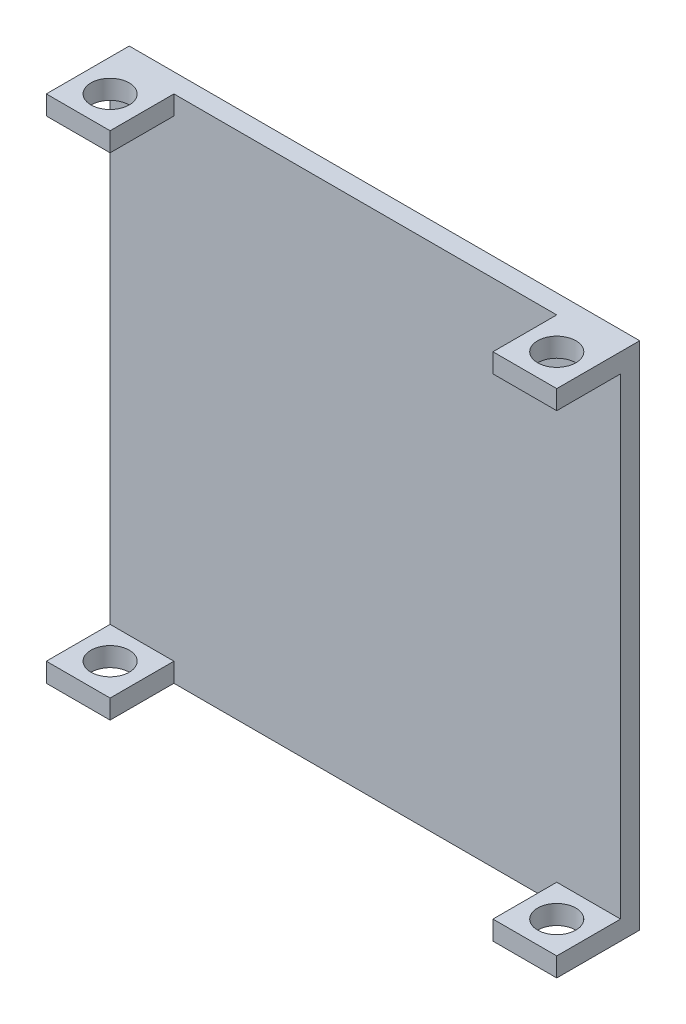
from build123d import *

# Parameters (mm, degrees)
SKETCH1_W           = 80
SKETCH1_H           = 80
BOSS_EXTRUDE1_DEPTH = 3
SKETCH9_W           = 10
SKETCH9_H           = 10
SKETCH9_R           = 3
BOSS_EXTRUDE8_DEPTH = 3
BOSS_EXTRUDE9_START = -3
SKETCH10_W          = 10
SKETCH10_H          = 10
SKETCH10_R          = 3
BOSS_EXTRUDE9_DEPTH = 3


with BuildPart() as part:
    # Sketch1 → Boss-Extrude1 (new body)
    with BuildSketch(Plane.XY):
        Rectangle(SKETCH1_W, SKETCH1_H)
    extrude(amount=BOSS_EXTRUDE1_DEPTH)

    # Sketch9 → Boss-Extrude8 (add)
    # profile 1 of 2: a face of its own
    with BuildSketch(Plane(origin=(0, 40, 0), x_dir=(1, 0, 0), z_dir=(0, 1, 0))):
        with Locations((-35, -8)):
            Rectangle(SKETCH9_W, SKETCH9_H)
        with Locations(Location((-35, -8, 0), (0, 0, 270))):
            Circle(SKETCH9_R, mode=Mode.SUBTRACT)
    # profile 2 of 2: a face of its own
    with BuildSketch(Plane(origin=(0, 40, 0), x_dir=(1, 0, 0), z_dir=(0, 1, 0))):
        with Locations((35, -8)):
            Rectangle(SKETCH9_W, SKETCH9_H)
        with Locations(Location((35, -8, 0), (0, 0, 270))):
            Circle(SKETCH9_R, mode=Mode.SUBTRACT)
    extrude(amount=-BOSS_EXTRUDE8_DEPTH)

    # Sketch10 → Boss-Extrude9 (add)
    # profile 1 of 2: a face of its own
    with BuildSketch(Plane.XZ.offset(40).offset(BOSS_EXTRUDE9_START)):
        with Locations((-35, 8)):
            Rectangle(SKETCH10_W, SKETCH10_H)
        with Locations(Location((-35, 8, 0), (0, 0, 90))):
            Circle(SKETCH10_R, mode=Mode.SUBTRACT)
    # profile 2 of 2: a face of its own
    with BuildSketch(Plane.XZ.offset(40).offset(BOSS_EXTRUDE9_START)):
        with Locations((35, 8)):
            Rectangle(SKETCH10_W, SKETCH10_H)
        with Locations(Location((35, 8, 0), (0, 0, 90))):
            Circle(SKETCH10_R, mode=Mode.SUBTRACT)
    extrude(amount=BOSS_EXTRUDE9_DEPTH)


solid = part.part
